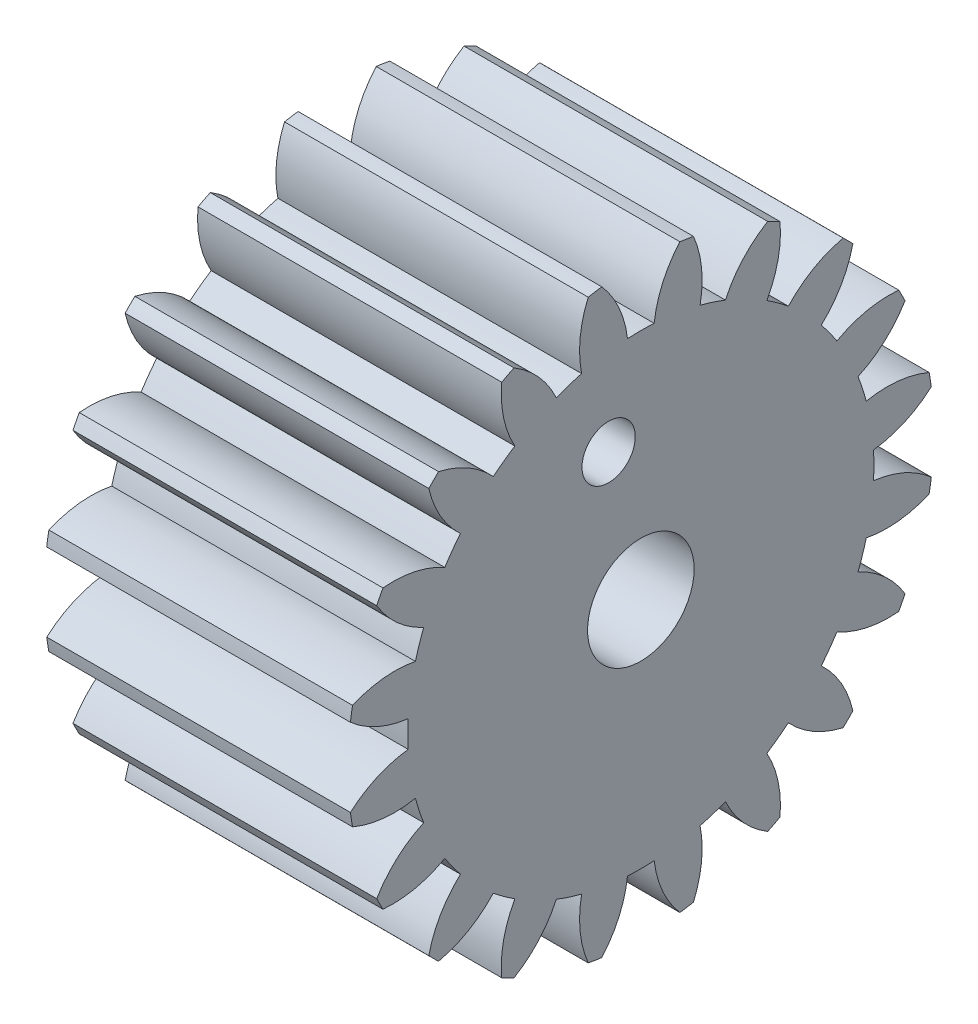
from build123d import *

# Parameters (mm, degrees)
SKETCH_7_R      = 1
SKETCH_7_R_2    = 0.5
EXTRUDE_3_DEPTH = 5.7


with BuildPart() as part:
    # 草图7 → 凸台-拉伸3 (new body)
    with BuildSketch(Plane(origin=(0, 0, 0), x_dir=(0, 0, -1), z_dir=(1, 0, 0))):
        with BuildLine():
            ThreePointArc((-5.451006848, 0.732478218), (-4.945547363, 0.408928549), (-4.366855207, 0.249903181))
            ThreePointArc((-4.366855207, 0.249903181), (-4.374, 0), (-4.366855207, -0.249903181))
            ThreePointArc((-4.366855207, -0.249903181), (-4.945547363, -0.408928549), (-5.451006848, -0.732478218))
            ThreePointArc((-5.451006848, -0.732478218), (-5.432285873, -0.860389558), (-5.410563801, -0.987825571))
            ThreePointArc((-5.410563801, -0.987825571), (-4.829860918, -1.139344021), (-4.23035043, -1.111760422))
            ThreePointArc((-4.23035043, -1.111760422), (-4.159921202, -1.351640333), (-4.075901771, -1.58710452))
            ThreePointArc((-4.075901771, -1.58710452), (-4.577129176, -1.917172343), (-4.957867366, -2.381081934))
            ThreePointArc((-4.957867366, -2.381081934), (-4.900535883, -2.496947749), (-4.840497071, -2.61143411))
            ThreePointArc((-4.840497071, -2.61143411), (-4.241394034, -2.576089659), (-3.679749479, -2.364597169))
            ThreePointArc((-3.679749479, -2.364597169), (-3.538640333, -2.570972694), (-3.38597067, -2.76894901))
            ThreePointArc((-3.38597067, -2.76894901), (-3.760669693, -3.23774995), (-3.979417283, -3.796608762))
            ThreePointArc((-3.979417283, -3.796608762), (-3.889087297, -3.889087297), (-3.796608762, -3.979417283))
            ThreePointArc((-3.796608762, -3.979417283), (-3.23774995, -3.760669693), (-2.76894901, -3.38597067))
            ThreePointArc((-2.76894901, -3.38597067), (-2.570972694, -3.538640333), (-2.364597169, -3.679749479))
            ThreePointArc((-2.364597169, -3.679749479), (-2.576089659, -4.241394034), (-2.61143411, -4.840497071))
            ThreePointArc((-2.61143411, -4.840497071), (-2.496947749, -4.900535883), (-2.381081934, -4.957867366))
            ThreePointArc((-2.381081934, -4.957867366), (-1.917172343, -4.577129176), (-1.58710452, -4.075901771))
            ThreePointArc((-1.58710452, -4.075901771), (-1.351640333, -4.159921202), (-1.111760422, -4.23035043))
            ThreePointArc((-1.111760422, -4.23035043), (-1.139344021, -4.829860918), (-0.987825571, -5.410563801))
            ThreePointArc((-0.987825571, -5.410563801), (-0.860389558, -5.432285873), (-0.732478218, -5.451006848))
            ThreePointArc((-0.732478218, -5.451006848), (-0.408928549, -4.945547363), (-0.249903181, -4.366855207))
            ThreePointArc((-0.249903181, -4.366855207), (0, -4.374), (0.249903181, -4.366855207))
            ThreePointArc((0.249903181, -4.366855207), (0.408928549, -4.945547363), (0.732478218, -5.451006848))
            ThreePointArc((0.732478218, -5.451006848), (0.860389558, -5.432285873), (0.987825571, -5.410563801))
            ThreePointArc((0.987825571, -5.410563801), (1.139344021, -4.829860918), (1.111760422, -4.23035043))
            ThreePointArc((1.111760422, -4.23035043), (1.351640333, -4.159921202), (1.58710452, -4.075901771))
            ThreePointArc((1.58710452, -4.075901771), (1.917172343, -4.577129176), (2.381081934, -4.957867366))
            ThreePointArc((2.381081934, -4.957867366), (2.496947749, -4.900535883), (2.61143411, -4.840497071))
            ThreePointArc((2.61143411, -4.840497071), (2.576089659, -4.241394034), (2.364597169, -3.679749479))
            ThreePointArc((2.364597169, -3.679749479), (2.570972694, -3.538640333), (2.76894901, -3.38597067))
            ThreePointArc((2.76894901, -3.38597067), (3.23774995, -3.760669693), (3.796608762, -3.979417283))
            ThreePointArc((3.796608762, -3.979417283), (3.889087297, -3.889087297), (3.979417283, -3.796608762))
            ThreePointArc((3.979417283, -3.796608762), (3.760669693, -3.23774995), (3.38597067, -2.76894901))
            ThreePointArc((3.38597067, -2.76894901), (3.538640333, -2.570972694), (3.679749479, -2.364597169))
            ThreePointArc((3.679749479, -2.364597169), (4.241394034, -2.576089659), (4.840497071, -2.61143411))
            ThreePointArc((4.840497071, -2.61143411), (4.900535883, -2.496947749), (4.957867366, -2.381081934))
            ThreePointArc((4.957867366, -2.381081934), (4.577129176, -1.917172343), (4.075901771, -1.58710452))
            ThreePointArc((4.075901771, -1.58710452), (4.159921202, -1.351640333), (4.23035043, -1.111760422))
            ThreePointArc((4.23035043, -1.111760422), (4.829860918, -1.139344021), (5.410563801, -0.987825571))
            ThreePointArc((5.410563801, -0.987825571), (5.432285873, -0.860389558), (5.451006848, -0.732478218))
            ThreePointArc((5.451006848, -0.732478218), (4.945547363, -0.408928549), (4.366855207, -0.249903181))
            ThreePointArc((4.366855207, -0.249903181), (4.374, 0), (4.366855207, 0.249903181))
            ThreePointArc((4.366855207, 0.249903181), (4.945547363, 0.408928549), (5.451006848, 0.732478218))
            ThreePointArc((5.451006848, 0.732478218), (5.432285873, 0.860389558), (5.410563801, 0.987825571))
            ThreePointArc((5.410563801, 0.987825571), (4.829860918, 1.139344021), (4.23035043, 1.111760422))
            ThreePointArc((4.23035043, 1.111760422), (4.159921202, 1.351640333), (4.075901771, 1.58710452))
            ThreePointArc((4.075901771, 1.58710452), (4.577129176, 1.917172343), (4.957867366, 2.381081934))
            ThreePointArc((4.957867366, 2.381081934), (4.900535883, 2.496947749), (4.840497071, 2.61143411))
            ThreePointArc((4.840497071, 2.61143411), (4.241394034, 2.576089659), (3.679749479, 2.364597169))
            ThreePointArc((3.679749479, 2.364597169), (3.538640333, 2.570972694), (3.38597067, 2.76894901))
            ThreePointArc((3.38597067, 2.76894901), (3.760669693, 3.23774995), (3.979417283, 3.796608762))
            ThreePointArc((3.979417283, 3.796608762), (3.889087297, 3.889087297), (3.796608762, 3.979417283))
            ThreePointArc((3.796608762, 3.979417283), (3.23774995, 3.760669693), (2.76894901, 3.38597067))
            ThreePointArc((2.76894901, 3.38597067), (2.570972694, 3.538640333), (2.364597169, 3.679749479))
            ThreePointArc((2.364597169, 3.679749479), (2.576089659, 4.241394034), (2.61143411, 4.840497071))
            ThreePointArc((2.61143411, 4.840497071), (2.496947749, 4.900535883), (2.381081934, 4.957867366))
            ThreePointArc((2.381081934, 4.957867366), (1.917172343, 4.577129176), (1.58710452, 4.075901771))
            ThreePointArc((1.58710452, 4.075901771), (1.351640333, 4.159921202), (1.111760422, 4.23035043))
            ThreePointArc((1.111760422, 4.23035043), (1.139344021, 4.829860918), (0.987825571, 5.410563801))
            ThreePointArc((0.987825571, 5.410563801), (0.860389558, 5.432285873), (0.732478218, 5.451006848))
            ThreePointArc((0.732478218, 5.451006848), (0.408928549, 4.945547363), (0.249903181, 4.366855207))
            ThreePointArc((0.249903181, 4.366855207), (0, 4.374), (-0.249903181, 4.366855207))
            ThreePointArc((-0.249903181, 4.366855207), (-0.408928549, 4.945547363), (-0.732478218, 5.451006848))
            ThreePointArc((-0.732478218, 5.451006848), (-0.860389558, 5.432285873), (-0.987825571, 5.410563801))
            ThreePointArc((-0.987825571, 5.410563801), (-1.139344021, 4.829860918), (-1.111760422, 4.23035043))
            ThreePointArc((-1.111760422, 4.23035043), (-1.351640333, 4.159921202), (-1.58710452, 4.075901771))
            ThreePointArc((-1.58710452, 4.075901771), (-1.917172343, 4.577129176), (-2.381081934, 4.957867366))
            ThreePointArc((-2.381081934, 4.957867366), (-2.496947749, 4.900535883), (-2.61143411, 4.840497071))
            ThreePointArc((-2.61143411, 4.840497071), (-2.576089659, 4.241394034), (-2.364597169, 3.679749479))
            ThreePointArc((-2.364597169, 3.679749479), (-2.570972694, 3.538640333), (-2.76894901, 3.38597067))
            ThreePointArc((-2.76894901, 3.38597067), (-3.23774995, 3.760669693), (-3.796608762, 3.979417283))
            ThreePointArc((-3.796608762, 3.979417283), (-3.889087297, 3.889087297), (-3.979417283, 3.796608762))
            ThreePointArc((-3.979417283, 3.796608762), (-3.760669693, 3.23774995), (-3.38597067, 2.76894901))
            ThreePointArc((-3.38597067, 2.76894901), (-3.538640333, 2.570972694), (-3.679749479, 2.364597169))
            ThreePointArc((-3.679749479, 2.364597169), (-4.241394034, 2.576089659), (-4.840497071, 2.61143411))
            ThreePointArc((-4.840497071, 2.61143411), (-4.900535883, 2.496947749), (-4.957867366, 2.381081934))
            ThreePointArc((-4.957867366, 2.381081934), (-4.577129176, 1.917172343), (-4.075901771, 1.58710452))
            ThreePointArc((-4.075901771, 1.58710452), (-4.159921202, 1.351640333), (-4.23035043, 1.111760422))
            ThreePointArc((-4.23035043, 1.111760422), (-4.829860918, 1.139344021), (-5.410563801, 0.987825571))
            ThreePointArc((-5.410563801, 0.987825571), (-5.432285873, 0.860389558), (-5.451006848, 0.732478218))
        make_face()
        Circle(SKETCH_7_R, mode=Mode.SUBTRACT)
        with Locations((-0.605093134, 2.703102347)):
            Circle(SKETCH_7_R_2, mode=Mode.SUBTRACT)
    extrude(amount=EXTRUDE_3_DEPTH)


solid = part.part
